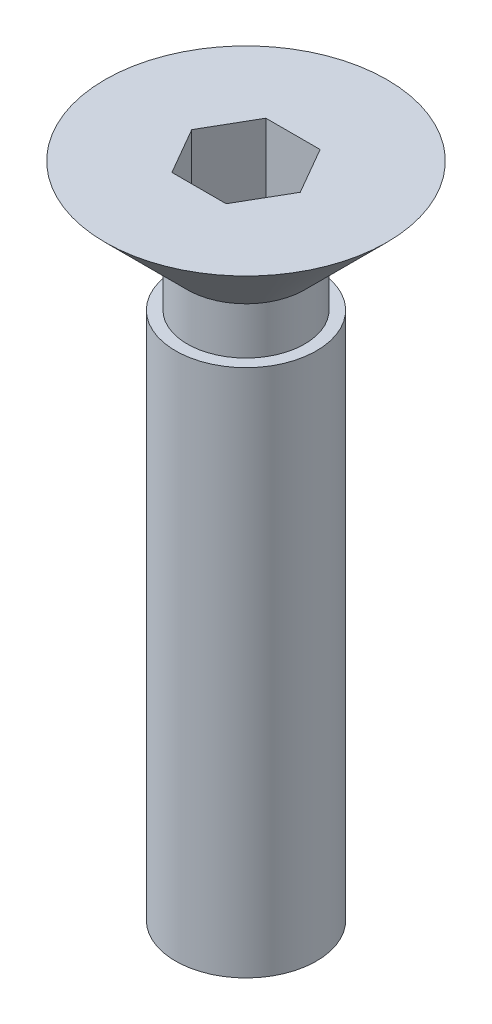
from build123d import *

# Parameters (mm, degrees)
CUT_EXTRUDE_1_DEPTH = 2


with BuildPart() as part:
    # 草图1 → 旋转1 (revolve)
    with BuildSketch(Plane.XY, mode=Mode.PRIVATE) as revolve_1_sk:
        Polygon((0, 14), (-3, 14), (-1.25, 12.25), (-1.25, 11.25), (-1.5, 11.25), (-1.5, 0), (0, 0), align=None)
    revolve(revolve_1_sk.sketch.rotate(Axis((0, 0, 0), (0, 1, 0)), 270), axis=Axis((0, 0, 0), (0, 1, 0)))

    # 草图2 → 切除-拉伸1 (cut)
    with BuildSketch(Plane(origin=(0, 14, 0), x_dir=(1, 0, 0), z_dir=(0, 1, 0))):
        Polygon((0.577350269, 1), (-0.577350269, 1), (-1.154700538, 0), (-0.577350269, -1), (0.577350269, -1), (1.154700538, 0), align=None)
    extrude(amount=-CUT_EXTRUDE_1_DEPTH, mode=Mode.SUBTRACT)


solid = part.part
